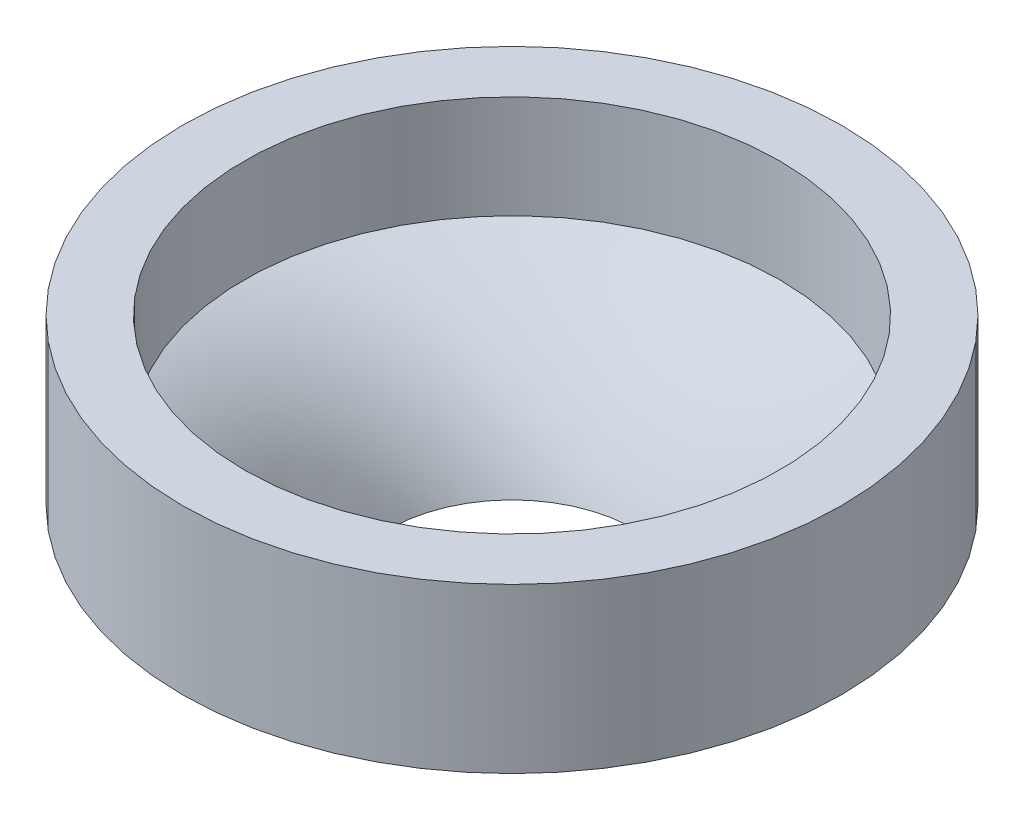
from build123d import *


with BuildPart() as part:
    # Sketch2 → Revolve1 (revolve)
    with BuildSketch(Plane(origin=(0, 0, 0), x_dir=(0, 0, -1), z_dir=(1, 0, 0))):
        with BuildLine():
            Line((-79.056436475, -40.260488846), (-79.056436475, -32.305924046))
            Line((-79.056436475, -32.305924046), (-76.056436475, -32.305924046))
            Line((-76.056436475, -32.305924046), (-76.056436475, -37.305924046))
            ThreePointArc((-76.056436475, -37.305924046), (-71.878817469, -40.12830504), (-69.056436475, -44.305924046))
            Line((-69.056436475, -44.305924046), (-72.148597446, -44.305924046))
            ThreePointArc((-72.148597446, -44.305924046), (-74.818485522, -40.944422681), (-79.056436475, -40.260488846))
        make_face()
    revolve(axis=Axis((0, -32.305924046, 63.056436475), (0, -1, 0)))


solid = part.part
